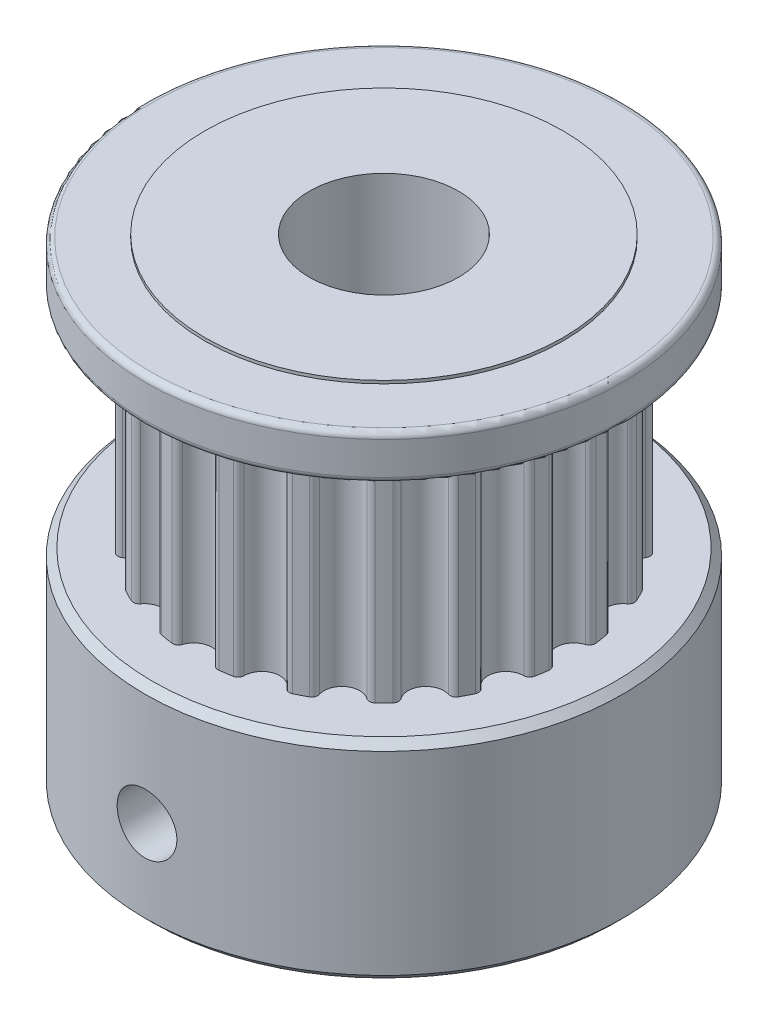
from build123d import *

# Parameters (mm, degrees)
SKETCH1_R                = 8
BOSS_EXTRUDE1_DEPTH      = 7
SKETCH2_R                = 6.365
BOSS_EXTRUDE2_DEPTH      = 7.5
SKETCH4_R                = 0.6
CUT_EXTRUDE1_DEPTH       = 7.5
FILLET1_R                = 0.2
CIRPATTERN1_COUNT        = 20
FILLET1_OF_CIRPATTERN1_R = 0.2
SKETCH3_R                = 8
BOSS_EXTRUDE3_DEPTH      = 1.5
SKETCH5_R                = 6
BOSS_EXTRUDE4_DEPTH      = 0.1
SKETCH7_R                = 2.5
CUT_EXTRUDE2_DEPTH       = 20.1
CHAMFER1_SIZE            = 0.25
FILLET2_R                = 0.2
SKETCH9_R                = 1
CUT_EXTRUDE3_DEPTH       = 7.1
CIRPATTERN2_COUNT        = 2
CIRPATTERN2_ANGLE        = 90


with BuildPart() as part:
    # Sketch1 → Boss-Extrude1 (new body)
    with BuildSketch(Plane(origin=(0, 0, 0), x_dir=(1, 0, 0), z_dir=(0, 1, 0))):
        with Locations(Location((0, 0, 0), (0, 0, 270))):
            Circle(SKETCH1_R)
    extrude(amount=BOSS_EXTRUDE1_DEPTH)

    # Sketch2 → Boss-Extrude2 (add)
    with BuildSketch(Plane(origin=(0, 7, 0), x_dir=(1, 0, 0), z_dir=(0, 1, 0))):
        with Locations(Location((0, 0, 0), (0, 0, 270))):
            Circle(SKETCH2_R)
    extrude(amount=BOSS_EXTRUDE2_DEPTH)

    # Sketch4 → Cut-Extrude1 (cut)
    with BuildSketch(Plane(origin=(0, 14.5, 0), x_dir=(1, 0, 0), z_dir=(0, 1, 0))):
        with Locations((0, 6.365)):
            Circle(SKETCH4_R)
    cut_extrude1 = extrude(amount=-CUT_EXTRUDE1_DEPTH, mode=Mode.SUBTRACT)

    # Fillet1
    fillet1_edges = [part.edges().sort_by_distance(p)[0] for p in [
        (0.59933318, 10.75, -6.336720346),
        (-0.59933318, 10.75, -6.336720346),
    ]]
    fillet(fillet1_edges, radius=FILLET1_R)

    # CirPattern1: Cut-Extrude1 ×20 about axis
    cirpattern1_axis = Axis((0, 0, 0), (0, 1, 0))
    for i in range(1, CIRPATTERN1_COUNT):
        add(cut_extrude1.rotate(cirpattern1_axis, i * 360 / CIRPATTERN1_COUNT), mode=Mode.SUBTRACT)

    # Fillet1 of CirPattern1
    fillet1_of_cirpattern1_edges = [part.edges().sort_by_distance(p)[0] for p in [
        (-1.388154549, 10.75, -6.211783315),
        (-2.528154002, 10.75, -5.841375039),
        (-3.239760039, 10.75, -5.478793653),
        (-4.209501495, 10.75, -4.774235244),
        (-4.774235244, 10.75, -4.209501495),
        (-5.478793653, 10.75, -3.239760039),
        (-5.841375039, 10.75, -2.528154002),
        (-6.211783315, 10.75, -1.388154549),
        (-6.336720346, 10.75, -0.59933318),
        (-6.336720346, 10.75, 0.59933318),
        (-6.211783315, 10.75, 1.388154549),
        (-5.841375039, 10.75, 2.528154002),
        (-5.478793653, 10.75, 3.239760039),
        (-4.774235244, 10.75, 4.209501495),
        (-4.209501495, 10.75, 4.774235244),
        (-3.239760039, 10.75, 5.478793653),
        (-2.528154002, 10.75, 5.841375039),
        (-1.388154549, 10.75, 6.211783315),
        (-0.59933318, 10.75, 6.336720346),
        (0.59933318, 10.75, 6.336720346),
        (1.388154549, 10.75, 6.211783315),
        (2.528154002, 10.75, 5.841375039),
        (3.239760039, 10.75, 5.478793653),
        (4.209501495, 10.75, 4.774235244),
        (4.774235244, 10.75, 4.209501495),
        (5.478793653, 10.75, 3.239760039),
        (5.841375039, 10.75, 2.528154002),
        (6.211783315, 10.75, 1.388154549),
        (6.336720346, 10.75, 0.59933318),
        (6.336720346, 10.75, -0.59933318),
        (6.211783315, 10.75, -1.388154549),
        (5.841375039, 10.75, -2.528154002),
        (5.478793653, 10.75, -3.239760039),
        (4.774235244, 10.75, -4.209501495),
        (4.209501495, 10.75, -4.774235244),
        (3.239760039, 10.75, -5.478793653),
        (2.528154002, 10.75, -5.841375039),
        (1.388154549, 10.75, -6.211783315),
    ]]
    fillet(fillet1_of_cirpattern1_edges, radius=FILLET1_OF_CIRPATTERN1_R)

    # Sketch3 → Boss-Extrude3 (add)
    with BuildSketch(Plane(origin=(0, 14.5, 0), x_dir=(1, 0, 0), z_dir=(0, 1, 0))):
        with Locations(Location((0, 0, 0), (0, 0, 270))):
            Circle(SKETCH3_R)
    extrude(amount=BOSS_EXTRUDE3_DEPTH)

    # Sketch5 → Boss-Extrude4 (add)
    with BuildSketch(Plane(origin=(0, 16, 0), x_dir=(1, 0, 0), z_dir=(0, 1, 0))):
        with Locations(Location((0, 0, 0), (0, 0, 270))):
            Circle(SKETCH5_R)
    extrude(amount=BOSS_EXTRUDE4_DEPTH)

    # Sketch7 → Cut-Extrude2 (cut)
    with BuildSketch(Plane(origin=(0, 0, 0), x_dir=(1, 0, 0), z_dir=(0, 1, 0))):
        with Locations(Location((0, 0, 0), (0, 0, 270))):
            Circle(SKETCH7_R)
    extrude(amount=CUT_EXTRUDE2_DEPTH, mode=Mode.SUBTRACT)

    # Chamfer1
    chamfer1_edges = [part.edges().sort_by_distance(p)[0] for p in [
        (0, 0, -8),
        (0, 7, -8),
    ]]
    chamfer(chamfer1_edges, length=CHAMFER1_SIZE)

    # Fillet2
    fillet2_edges = [part.edges().sort_by_distance(p)[0] for p in [
        (0, 14.5, -8),
        (0, 16, -8),
    ]]
    fillet(fillet2_edges, radius=FILLET2_R)

    # Sketch9 → Cut-Extrude3 (cut)
    with BuildSketch(Plane.XY.offset(8)):
        with Locations((0, 3)):
            Circle(SKETCH9_R)
    cut_extrude3 = extrude(amount=-CUT_EXTRUDE3_DEPTH, mode=Mode.SUBTRACT)

    # CirPattern2: Cut-Extrude3 ×2 about axis
    cirpattern2_axis = Axis((0, 7, 0), (0, -1, 0))
    for i in range(1, CIRPATTERN2_COUNT):
        add(cut_extrude3.rotate(cirpattern2_axis, i * CIRPATTERN2_ANGLE / (CIRPATTERN2_COUNT - 1)), mode=Mode.SUBTRACT)


solid = part.part
